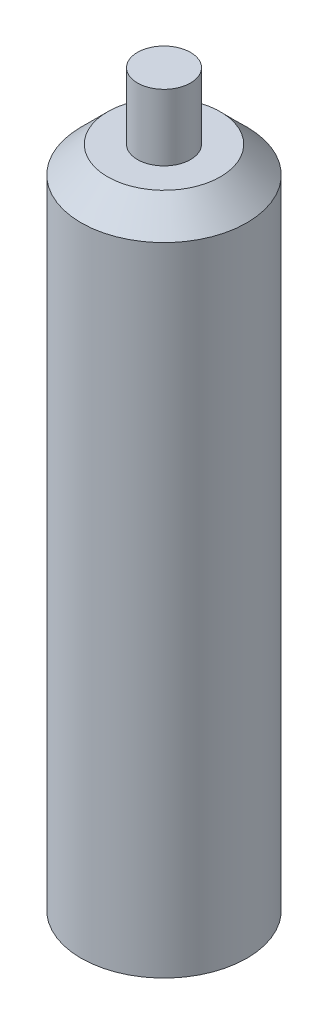
from build123d import *

# Parameters (mm, degrees)
SKETCH1_R           = 6.25
BOSS_EXTRUDE1_DEPTH = 50
SKETCH2_R           = 2
BOSS_EXTRUDE2_DEPTH = 5
CHAMFER1_SIZE       = 2


with BuildPart() as part:
    # Sketch1 → Boss-Extrude1 (new body)
    with BuildSketch(Plane(origin=(0, 0, 0), x_dir=(1, 0, 0), z_dir=(0, 1, 0))):
        with Locations(Location((0, 0, 0), (0, 0, 270))):
            Circle(SKETCH1_R)
    extrude(amount=BOSS_EXTRUDE1_DEPTH)

    # Sketch2 → Boss-Extrude2 (add)
    with BuildSketch(Plane(origin=(0, 50, 0), x_dir=(1, 0, 0), z_dir=(0, 1, 0))):
        with Locations(Location((0, 0, 0), (0, 0, 270))):
            Circle(SKETCH2_R)
    extrude(amount=BOSS_EXTRUDE2_DEPTH)

    # Chamfer1
    chamfer1_edges = [part.edges().sort_by_distance(p)[0] for p in [
        (0, 50, -6.25),
    ]]
    chamfer(chamfer1_edges, length=CHAMFER1_SIZE)


solid = part.part
